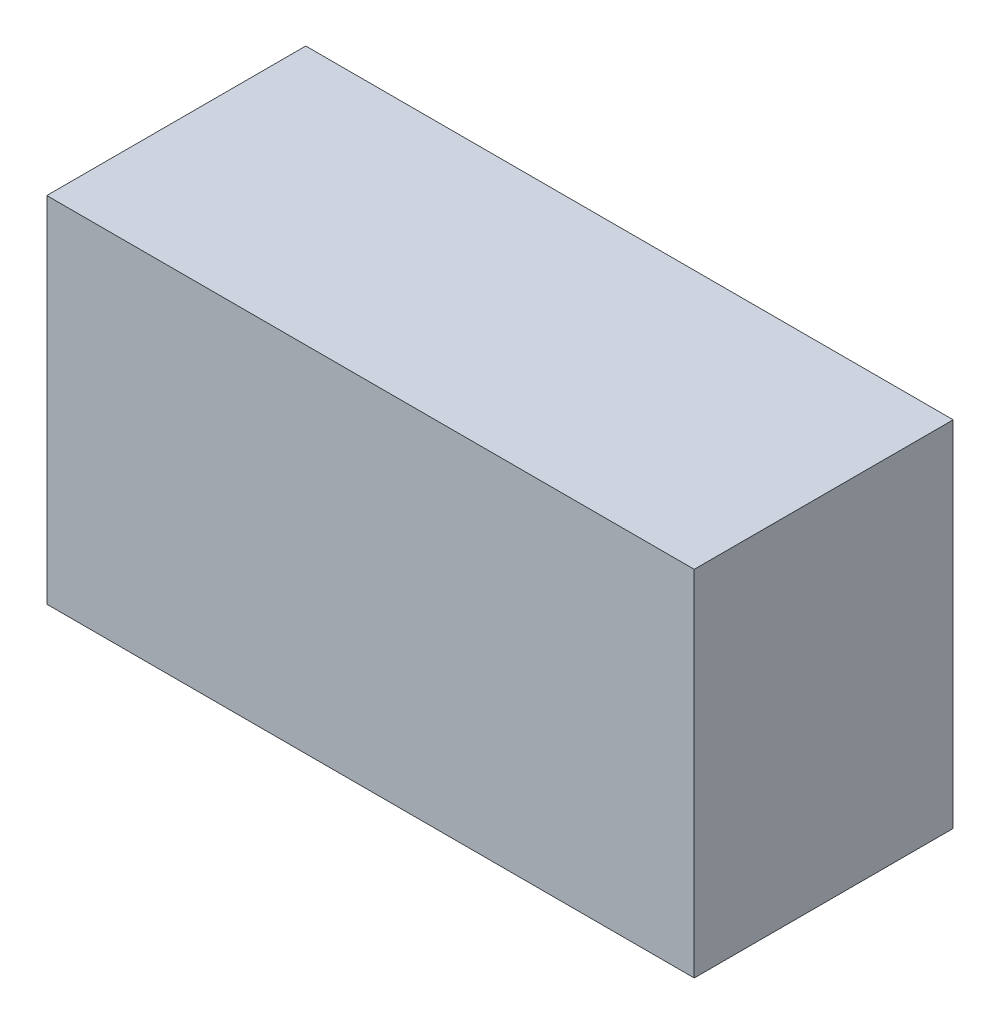
from build123d import *

# Parameters (mm, degrees)
SKETCH1_W           = 75
SKETCH1_H           = 41
BOSS_EXTRUDE1_DEPTH = 30


with BuildPart() as part:
    # Sketch1 → Boss-Extrude1 (new body)
    with BuildSketch(Plane.XY):
        Rectangle(SKETCH1_W, SKETCH1_H)
    extrude(amount=BOSS_EXTRUDE1_DEPTH)


solid = part.part
